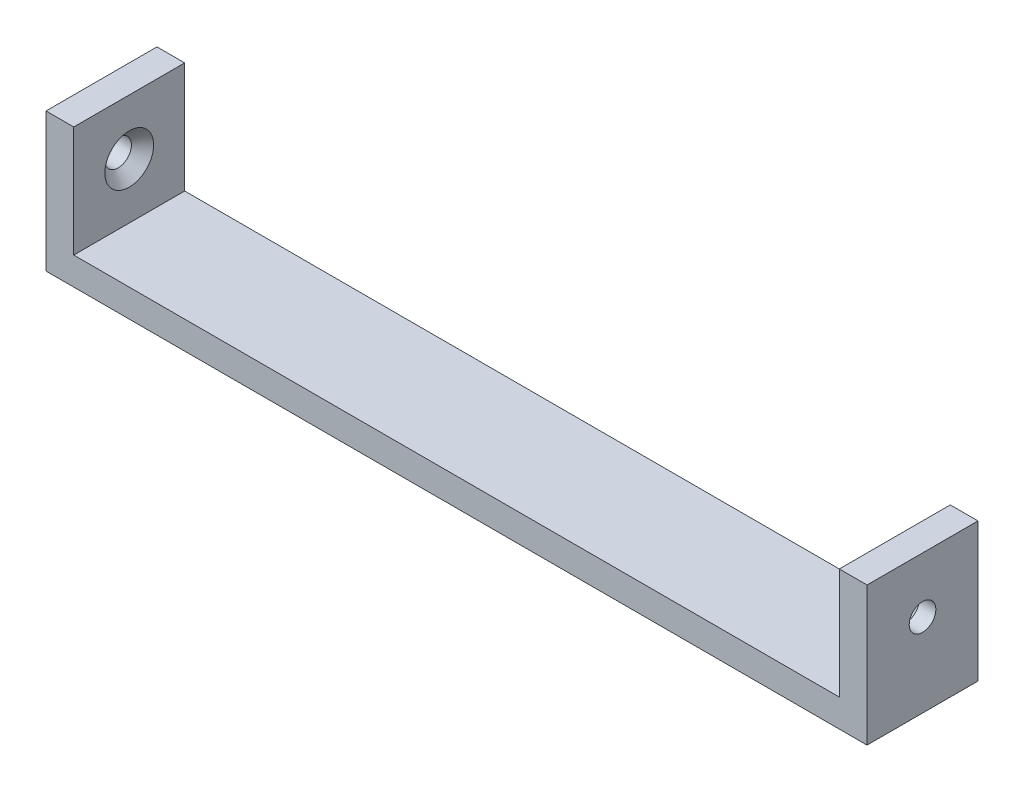
from build123d import *

# Parameters (mm, degrees)
SKETCH2_W                                       = 74
SKETCH2_H                                       = 10
BOSS_EXTRUDE1_DEPTH                             = 2.5
SKETCH3_W                                       = 2.5
SKETCH3_H                                       = 10
BOSS_EXTRUDE2_DEPTH                             = 10
CSK_FOR_M2_FLAT_HEAD_MACHINE_SCREW1_D           = 2.4
CSK_FOR_M2_FLAT_HEAD_MACHINE_SCREW1_DEPTH       = 2.5
CSK_FOR_M2_FLAT_HEAD_MACHINE_SCREW1_CSINK_D     = 4.4
CSK_FOR_M2_FLAT_HEAD_MACHINE_SCREW1_CSINK_ANGLE = 90
CSK_FOR_M2_FLAT_HEAD_MACHINE_SCREW2_D           = 2.4
CSK_FOR_M2_FLAT_HEAD_MACHINE_SCREW2_DEPTH       = 2.5
CSK_FOR_M2_FLAT_HEAD_MACHINE_SCREW2_CSINK_D     = 4.4
CSK_FOR_M2_FLAT_HEAD_MACHINE_SCREW2_CSINK_ANGLE = 90


with BuildPart() as part:
    # Sketch2 → Boss-Extrude1 (new body)
    with BuildSketch(Plane(origin=(0, 0, 0), x_dir=(1, 0, 0), z_dir=(0, 1, 0))):
        with Locations((25.358263924, 0.691988738)):
            Rectangle(SKETCH2_W, SKETCH2_H)
    extrude(amount=BOSS_EXTRUDE1_DEPTH)

    # Sketch3 → Boss-Extrude2 (add)
    with BuildSketch(Plane(origin=(0, 2.5, 0), x_dir=(1, 0, 0), z_dir=(0, 1, 0))):
        with Locations((-10.391736076, 0.691988738)):
            Rectangle(SKETCH3_W, SKETCH3_H)
        with Locations((61.108263924, 0.691988738)):
            Rectangle(SKETCH3_W, SKETCH3_H)
    extrude(amount=BOSS_EXTRUDE2_DEPTH)

    # CSK for M2 Flat Head Machine Screw1
    with Locations(Plane.ZY.offset(-59.858263924)):
        with Locations((-0.691988738, 7.5)):
            CounterSinkHole(CSK_FOR_M2_FLAT_HEAD_MACHINE_SCREW1_D / 2, CSK_FOR_M2_FLAT_HEAD_MACHINE_SCREW1_CSINK_D / 2, depth=CSK_FOR_M2_FLAT_HEAD_MACHINE_SCREW1_DEPTH, counter_sink_angle=CSK_FOR_M2_FLAT_HEAD_MACHINE_SCREW1_CSINK_ANGLE)

    # CSK for M2 Flat Head Machine Screw2
    with Locations(Plane(origin=(-9.141736076, 0, 0), x_dir=(0, 0, -1), z_dir=(1, 0, 0))):
        with Locations((0.691988738, 7.5)):
            CounterSinkHole(CSK_FOR_M2_FLAT_HEAD_MACHINE_SCREW2_D / 2, CSK_FOR_M2_FLAT_HEAD_MACHINE_SCREW2_CSINK_D / 2, depth=CSK_FOR_M2_FLAT_HEAD_MACHINE_SCREW2_DEPTH, counter_sink_angle=CSK_FOR_M2_FLAT_HEAD_MACHINE_SCREW2_CSINK_ANGLE)


solid = part.part
